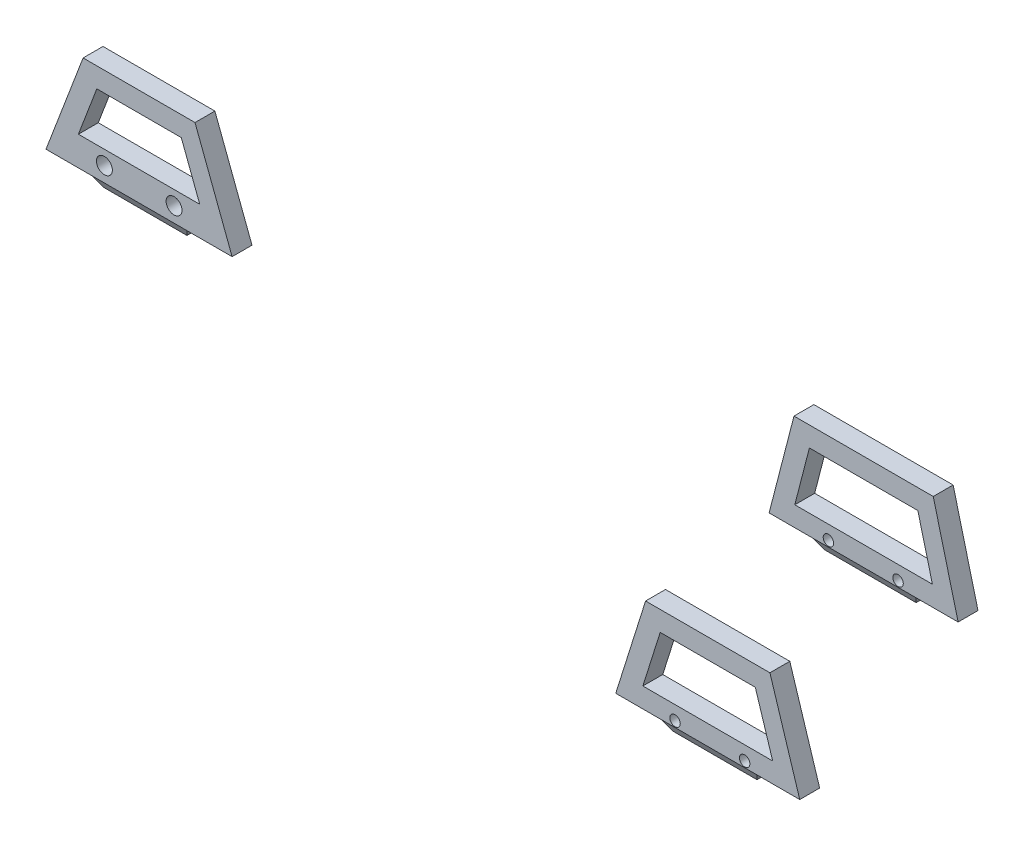
from build123d import *

# Parameters (mm, degrees)
SKETCH1_R             = 1.6
BOSS_EXTRUDE1_DEPTH   = 4
SKETCH1_R_2           = 1.05
BOSS_EXTRUDE1_2_DEPTH = 4
BOSS_EXTRUDE1_3_DEPTH = 4
SKETCH2_W             = 19.141460354
SKETCH2_H             = 4
BOSS_EXTRUDE2_DEPTH   = 2
BOSS_EXTRUDE2_TAPER   = 30
SKETCH3_W             = 20.807734038
SKETCH3_H             = 4
BOSS_EXTRUDE3_DEPTH   = 2
BOSS_EXTRUDE3_TAPER   = 30
SKETCH4_W             = 19.273334359
SKETCH4_H             = 4
BOSS_EXTRUDE4_DEPTH   = 2
BOSS_EXTRUDE4_TAPER   = 30


with BuildPart() as part:
    # Sketch1 → Boss-Extrude1 (new body)
    with BuildSketch(Plane.XY):
        Polygon((-55.444244203, 22.063226417), (-32.944244203, 22.063226417), (-25.483717887, 2.433133521), (-62.904770519, 2.433133521), align=None)
        with Locations((-51.159681031, 5.4578108)):
            Circle(SKETCH1_R, mode=Mode.SUBTRACT)
        with Locations((-37.15968106, 5.458714772)):
            Circle(SKETCH1_R, mode=Mode.SUBTRACT)
        Polygon((-52.685322224, 18.063226417), (-35.703166182, 18.063226417), (-31.993610812, 8.302666178), (-56.394877594, 8.302666178), align=None, mode=Mode.SUBTRACT)
    extrude(amount=BOSS_EXTRUDE1_DEPTH)

    # Sketch2 → Boss-Extrude2 (add)
    with BuildSketch(Plane.XZ.offset(-2.433133521)):
        with Locations((-44.138002497, 2)):
            Rectangle(SKETCH2_W, SKETCH2_H)
    extrude(amount=BOSS_EXTRUDE2_DEPTH, taper=BOSS_EXTRUDE2_TAPER)


with BuildPart() as body_2:
    # Sketch1 → Boss-Extrude1 2 (new body)
    with BuildSketch(Plane.XY):
        Polygon((87.495445367, 31.168760327), (115.495445367, 31.168760327), (120.495445367, 11.803843596), (82.495445367, 11.803843596), align=None)
        with Locations((94.420291335, 12.999756858)):
            Circle(SKETCH1_R_2, mode=Mode.SUBTRACT)
        with Locations((108.420291335, 12.999750534)):
            Circle(SKETCH1_R_2, mode=Mode.SUBTRACT)
        Polygon((90.593832044, 27.168760327), (112.39705869, 27.168760327), (115.331467572, 15.803843596), (87.659423162, 15.803843596), align=None, mode=Mode.SUBTRACT)
    extrude(amount=BOSS_EXTRUDE1_2_DEPTH)

    # Sketch3 → Boss-Extrude3 (add)
    with BuildSketch(Plane.XZ.offset(-11.803843596)):
        with Locations((101.657236315, 2)):
            Rectangle(SKETCH3_W, SKETCH3_H)
    extrude(amount=BOSS_EXTRUDE3_DEPTH, taper=BOSS_EXTRUDE3_TAPER)


with BuildPart() as body_3:
    # Sketch1 → Boss-Extrude1 3 (new body)
    with BuildSketch(Plane.XY):
        Polygon((57.655749748, -15.95040789), (82.655749748, -15.95040789), (88.655749748, -35.029191918), (51.655749748, -35.029191918), align=None)
        with Locations((63.580595716, -33.833278656)):
            Circle(SKETCH1_R_2, mode=Mode.SUBTRACT)
        with Locations((77.580595716, -33.83328498)):
            Circle(SKETCH1_R_2, mode=Mode.SUBTRACT)
        Polygon((60.59094729, -19.95040789), (79.720552205, -19.95040789), (83.204668597, -31.029191918), (57.106830899, -31.029191918), align=None, mode=Mode.SUBTRACT)
    extrude(amount=BOSS_EXTRUDE1_3_DEPTH)

    # Sketch4 → Boss-Extrude4 (add)
    with BuildSketch(Plane.XZ.offset(35.029191918)):
        with Locations((70.419180003, 2)):
            Rectangle(SKETCH4_W, SKETCH4_H)
    extrude(amount=BOSS_EXTRUDE4_DEPTH, taper=BOSS_EXTRUDE4_TAPER)


solid = Compound([part.part, body_2.part, body_3.part])
